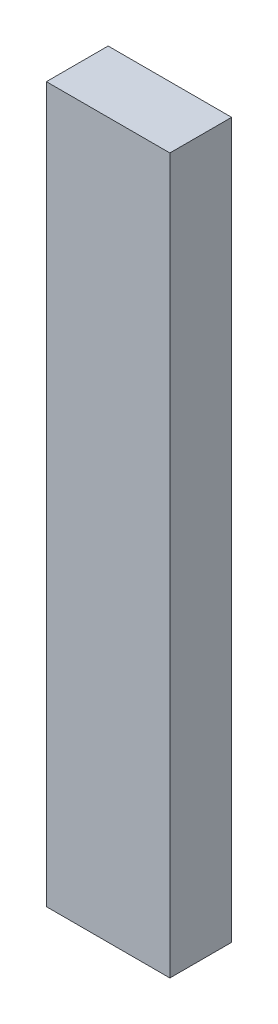
from build123d import *

# Parameters (mm, degrees)
SKETCH1_W           = 44.45
SKETCH1_H           = 22.225
BOSS_EXTRUDE1_DEPTH = 257.175


with BuildPart() as part:
    # Sketch1 → Boss-Extrude1 (new body)
    with BuildSketch(Plane(origin=(0, 0, 0), x_dir=(1, 0, 0), z_dir=(0, 1, 0))):
        with Locations((22.225, 11.1125)):
            Rectangle(SKETCH1_W, SKETCH1_H)
    extrude(amount=BOSS_EXTRUDE1_DEPTH)


solid = part.part
